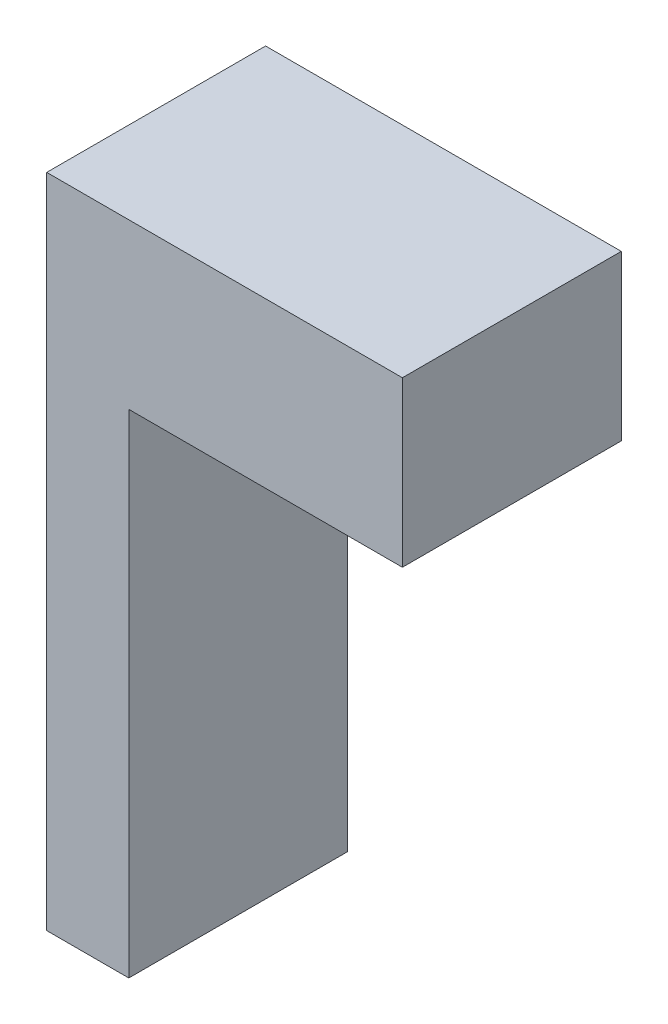
from build123d import *

# Parameters (mm, degrees)
BOSS_EXTRU_1_DEPTH = 40


with BuildPart() as part:
    # Esquisse1 → Boss.-Extru.1 (new body)
    with BuildSketch(Plane.XY):
        Polygon((0, 0), (50, 0), (50, 30), (-15, 30), (-15, -90), (0, -90), align=None)
    extrude(amount=BOSS_EXTRU_1_DEPTH)


solid = part.part
